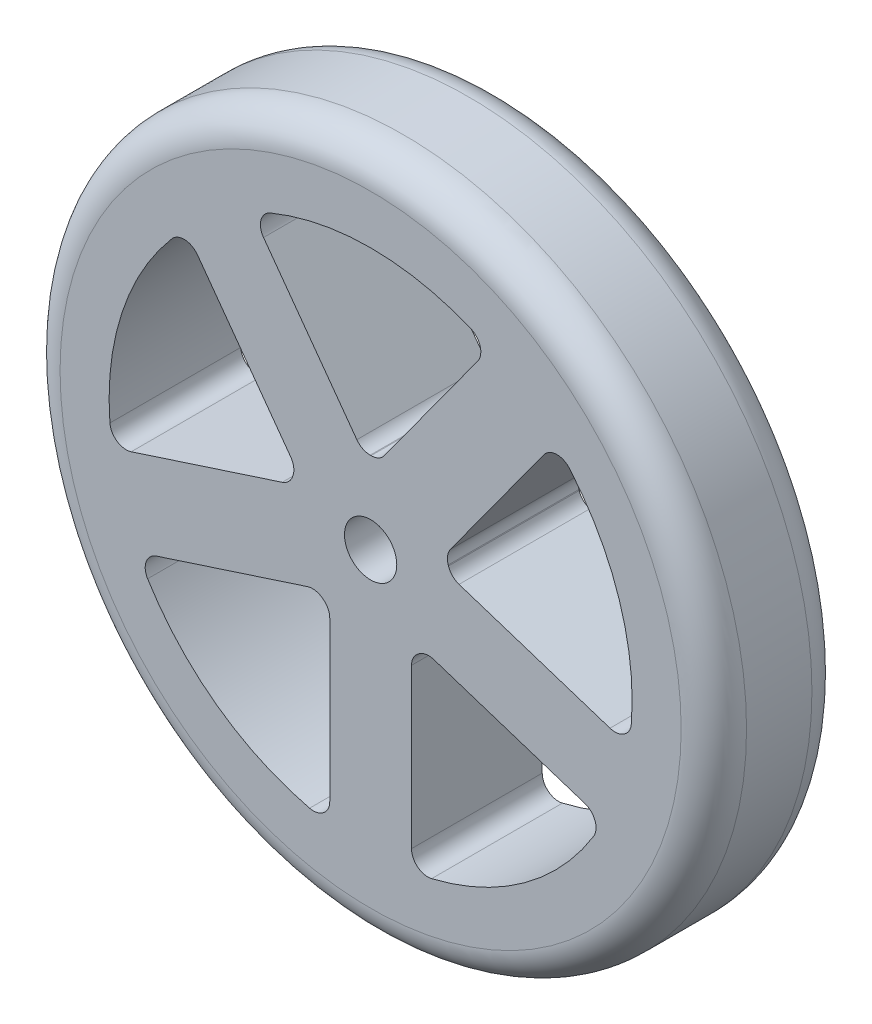
from build123d import *

# Parameters (mm, degrees)
ESQUISSE1_R                  = 105
BOSS_EXTRU_1_DEPTH           = 40
ENL_V_MAT_EXTRU_1_DEPTH      = 154.785564992
ENL_V_MAT_EXTRU_1_DEPTH_BACK = 154.785564992
ENL_V_MAT_EXTRU_2_DEPTH      = 154.785564992
ENL_V_MAT_EXTRU_2_DEPTH_BACK = 154.785564992
ESQUISSE3_R                  = 8
CONG_1_R                     = 5
CONG_2_R                     = 10


with BuildPart() as part:
    # Esquisse1 → Boss.-Extru.1 (new body)
    with BuildSketch(Plane.XY):
        Circle(ESQUISSE1_R)
    extrude(amount=BOSS_EXTRU_1_DEPTH)

    # Esquisse2 → Enlèv. mat.-Extru.1 (cut, two sides: drawn at the far end of the back side and taken through both)
    with BuildSketch(Plane.XY.offset(40).offset(-ENL_V_MAT_EXTRU_1_DEPTH_BACK)):
        with BuildLine():
            Line((2.613211582, 24.863047384), (36.332551814, 71.27373765))
            ThreePointArc((36.332551814, 71.27373765), (0, 80), (-36.332551814, 71.27373765))
            Line((-36.332551814, 71.27373765), (-2.613211582, 24.863047384))
            ThreePointArc((-2.613211582, 24.863047384), (0, 25), (2.613211582, 24.863047384))
        make_face()
        with BuildLine():
            Line((24.453690018, 5.19779227), (79.012728593, -12.52951397))
            ThreePointArc((79.012728593, -12.52951397), (76.084521304, 24.72135955), (56.557976674, 56.579106343))
            Line((56.557976674, 56.579106343), (22.838636441, 10.168416077))
            ThreePointArc((22.838636441, 10.168416077), (23.776412907, 7.725424859), (24.453690018, 5.19779227))
        make_face()
        with BuildLine():
            Line((12.5, -21.650635095), (12.5, -79.017403146))
            ThreePointArc((12.5, -79.017403146), (47.022820183, -64.72135955), (71.287303733, -36.305926877))
            Line((71.287303733, -36.305926877), (16.728265159, -18.578620637))
            ThreePointArc((16.728265159, -18.578620637), (14.694631307, -20.225424859), (12.5, -21.650635095))
        make_face()
        with BuildLine():
            Line((-16.728265159, -18.578620637), (-71.287303733, -36.305926877))
            ThreePointArc((-71.287303733, -36.305926877), (-47.022820183, -64.72135955), (-12.5, -79.017403146))
            Line((-12.5, -79.017403146), (-12.5, -21.650635095))
            ThreePointArc((-12.5, -21.650635095), (-14.694631307, -20.225424859), (-16.728265159, -18.578620637))
        make_face()
        with BuildLine():
            Line((-22.838636441, 10.168416077), (-56.557976674, 56.579106343))
            ThreePointArc((-56.557976674, 56.579106343), (-76.084521304, 24.72135955), (-79.012728593, -12.52951397))
            Line((-79.012728593, -12.52951397), (-24.453690018, 5.19779227))
            ThreePointArc((-24.453690018, 5.19779227), (-23.776412907, 7.725424859), (-22.838636441, 10.168416077))
        make_face()
    extrude(amount=ENL_V_MAT_EXTRU_1_DEPTH + ENL_V_MAT_EXTRU_1_DEPTH_BACK, mode=Mode.SUBTRACT)

    # Esquisse3 → Enlèv. mat.-Extru.2 (cut, two sides: drawn at the far end of the back side and taken through both)
    with BuildSketch(Plane.XY.offset(40).offset(-ENL_V_MAT_EXTRU_2_DEPTH_BACK)):
        Circle(ESQUISSE3_R)
    extrude(amount=ENL_V_MAT_EXTRU_2_DEPTH + ENL_V_MAT_EXTRU_2_DEPTH_BACK, mode=Mode.SUBTRACT)

    # Congé1
    cong_1_edges = [part.edges().sort_by_distance(p)[0] for p in [
        (-79.012728593, -12.52951397, 20),
        (-56.557976674, 56.579106343, 20),
        (-22.838636441, 10.168416077, 20),
        (-24.453690018, 5.19779227, 20),
        (-12.5, -79.017403146, 20),
        (-71.287303733, -36.305926877, 20),
        (-16.728265159, -18.578620637, 20),
        (-12.5, -21.650635095, 20),
        (71.287303733, -36.305926877, 20),
        (12.5, -79.017403146, 20),
        (12.5, -21.650635095, 20),
        (16.728265159, -18.578620637, 20),
        (56.557976674, 56.579106343, 20),
        (79.012728593, -12.52951397, 20),
        (24.453690018, 5.19779227, 20),
        (22.838636441, 10.168416077, 20),
        (-36.332551814, 71.27373765, 20),
        (36.332551814, 71.27373765, 20),
        (2.613211582, 24.863047384, 20),
        (-2.613211582, 24.863047384, 20),
    ]]
    fillet(cong_1_edges, radius=CONG_1_R)

    # Congé2
    cong_2_edges = [part.edges().sort_by_distance(p)[0] for p in [
        (-105, 0, 0),
        (-105, 0, 40),
    ]]
    fillet(cong_2_edges, radius=CONG_2_R)


solid = part.part
